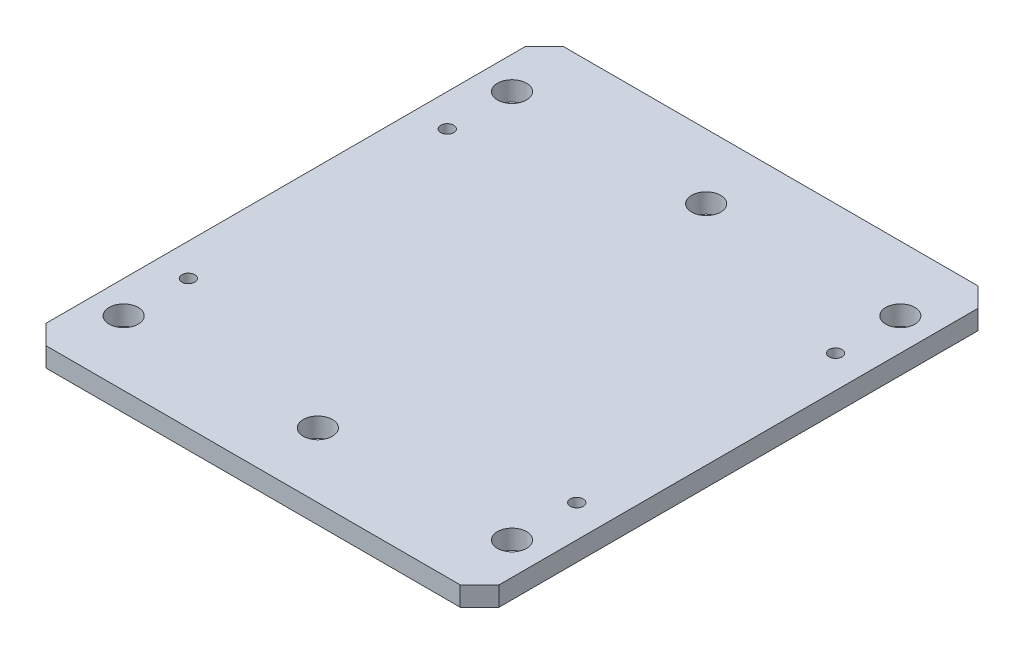
from build123d import *

# Parameters (mm, degrees)
ESQUISSE1_W             = 70
ESQUISSE1_H             = 12
BOSS_EXTRU_1_DEPTH      = 80
ESQUISSE2_W             = 12
ESQUISSE2_H             = 6
ENL_V_MAT_EXTRU_1_DEPTH = 107.976632963
ESQUISSE4_R             = 2.25
ENL_V_MAT_EXTRU_3_DEPTH = 107.976632963
ESQUISSE5_W             = 12
ESQUISSE5_H             = 10
BOSS_EXTRU_2_DEPTH      = 6
CHANFREIN1_SIZE         = 3
ESQUISSE6_R             = 1
ENL_V_MAT_EXTRU_4_DEPTH = 12
ESQUISSE8_W             = 70
ESQUISSE8_H             = 9
ENL_V_MAT_EXTRU_8_DEPTH = 80


with BuildPart() as part:
    # Esquisse1 → Boss.-Extru.1 (new body)
    with BuildSketch(Plane.XY):
        with Locations((35, 6)):
            Rectangle(ESQUISSE1_W, ESQUISSE1_H)
    extrude(amount=BOSS_EXTRU_1_DEPTH)

    # Esquisse2 → Enlèv. mat.-Extru.1 (cut, through all)
    with BuildSketch(Plane.XY.offset(80)):
        with Locations((52.5, 9)):
            Rectangle(ESQUISSE2_W, ESQUISSE2_H)
        with Locations((17.5, 9)):
            Rectangle(ESQUISSE2_W, ESQUISSE2_H)
    extrude(amount=-ENL_V_MAT_EXTRU_1_DEPTH, mode=Mode.SUBTRACT)

    # Esquisse4 → Enlèv. mat.-Extru.3 (cut, through all)
    with BuildSketch(Plane(origin=(0, 12, 0), x_dir=(1, 0, 0), z_dir=(0, 1, 0))):
        with Locations(Location((5, -10, 0), (0, 0, 270))):
            Circle(ESQUISSE4_R)
        with Locations(Location((65, -70, 0), (0, 0, 270))):
            Circle(ESQUISSE4_R)
        with Locations(Location((65, -10, 0), (0, 0, 90))):
            Circle(ESQUISSE4_R)
        with Locations(Location((5, -70, 0), (0, 0, 90))):
            Circle(ESQUISSE4_R)
        with Locations(Location((35, -10, 0), (0, 0, 270))):
            Circle(ESQUISSE4_R)
        with Locations(Location((35, -70, 0), (0, 0, 270))):
            Circle(ESQUISSE4_R)
    extrude(amount=-ENL_V_MAT_EXTRU_3_DEPTH, mode=Mode.SUBTRACT)

    # Esquisse5 → Boss.-Extru.2 (add)
    with BuildSketch(Plane(origin=(0, 12, 0), x_dir=(1, 0, 0), z_dir=(0, 1, 0))):
        with Locations((17.5, -75)):
            Rectangle(ESQUISSE5_W, ESQUISSE5_H)
        with Locations((52.5, -75)):
            Rectangle(ESQUISSE5_W, ESQUISSE5_H)
        with Locations((52.5, -5)):
            Rectangle(ESQUISSE5_W, ESQUISSE5_H)
        with Locations((17.5, -5)):
            Rectangle(ESQUISSE5_W, ESQUISSE5_H)
    extrude(amount=-BOSS_EXTRU_2_DEPTH)

    # Chanfrein1
    chanfrein1_edges = [part.edges().sort_by_distance(p)[0] for p in [
        (70, 6, 80),
        (0, 6, 80),
        (70, 6, 0),
        (0, 6, 0),
    ]]
    chamfer(chanfrein1_edges, length=CHANFREIN1_SIZE)

    # Esquisse6 → Enlèv. mat.-Extru.4 (cut)
    with BuildSketch(Plane(origin=(0, 12, 0), x_dir=(1, 0, 0), z_dir=(0, 1, 0))):
        with Locations(Location((5, -20, 0), (0, 0, 270))):
            Circle(ESQUISSE6_R)
        with Locations(Location((5, -60, 0), (0, 0, 90))):
            Circle(ESQUISSE6_R)
        with Locations(Location((65, -60, 0), (0, 0, 270))):
            Circle(ESQUISSE6_R)
        with Locations(Location((65, -20, 0), (0, 0, 90))):
            Circle(ESQUISSE6_R)
    extrude(amount=-ENL_V_MAT_EXTRU_4_DEPTH, mode=Mode.SUBTRACT)

    # Esquisse8 → Enlèv. mat.-Extru.8 (cut)
    with BuildSketch(Plane.XY.offset(80)):
        with Locations((35, 7.5)):
            Rectangle(ESQUISSE8_W, ESQUISSE8_H)
    extrude(amount=-ENL_V_MAT_EXTRU_8_DEPTH, mode=Mode.SUBTRACT)


solid = part.part
